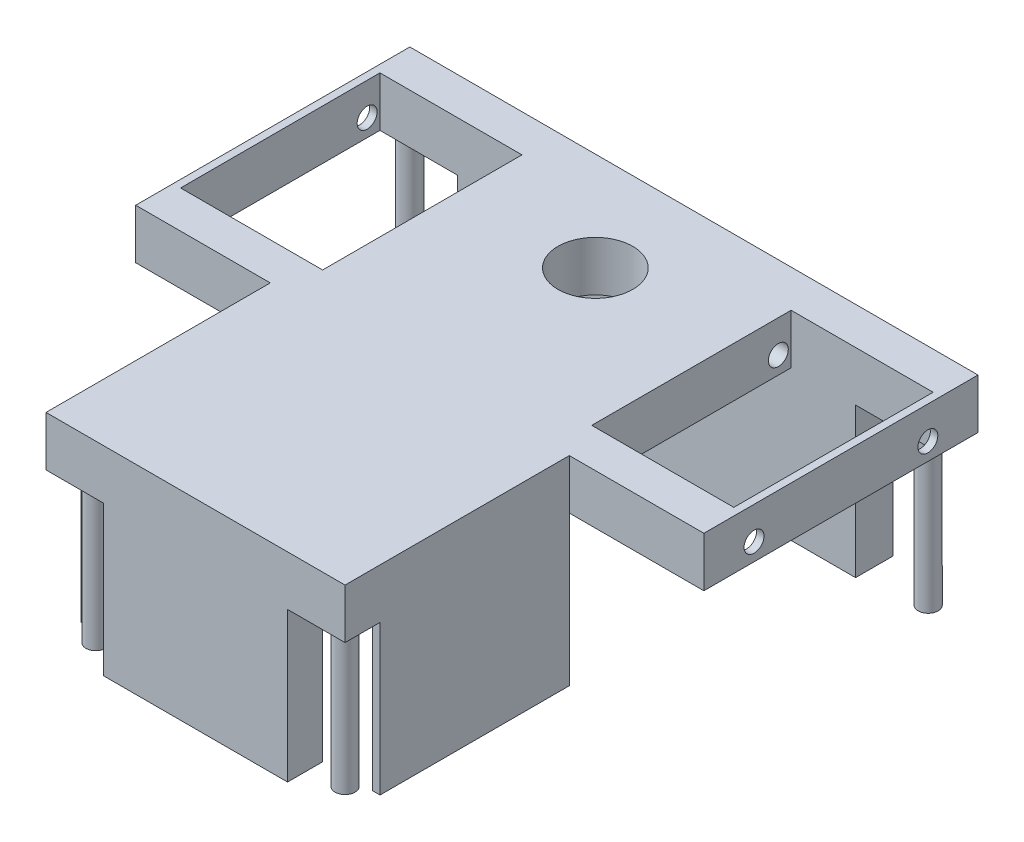
from build123d import *

# Parameters (mm, degrees)
BOSS_EXTRUDE1_DEPTH     = 10
CUT_EXTRUDE1_DEPTH      = 116.537872579
CUT_EXTRUDE1_DEPTH_BACK = 116.537872579
SKETCH2_R               = 2
SKETCH2_W               = 28.5
SKETCH2_H               = 40
SKETCH5_R               = 2
CUT_EXTRUDE2_DEPTH      = 152.973681932
SKETCH6_R               = 2
BOSS_EXTRUDE2_DEPTH     = 40
SKETCH7_W               = 79.874147132
SKETCH7_H               = 7.5
SKETCH7_W_2             = 36.93403835
SKETCH7_H_2             = 7.021862101
SKETCH7_W_3             = 1.5
SKETCH7_H_3             = 37.978137899
BOSS_EXTRUDE3_DEPTH     = 30
CUT_EXTRUDE3_DEPTH      = 122.856472951
CUT_EXTRUDE3_DEPTH_BACK = 122.856472951
SKETCH8_R               = 7.5


with BuildPart() as part:
    # Sketch1 → Boss-Extrude1 (new body)
    with BuildSketch(Plane(origin=(0, 0, 0), x_dir=(1, 0, 0), z_dir=(0, 1, 0))):
        Polygon((30, 0), (-30, 0), (-30, 45), (-57, 45), (-57, 100), (57, 100), (57, 45), (30, 45), align=None)
    extrude(amount=BOSS_EXTRUDE1_DEPTH)

    # Sketch2 → Cut-Extrude1 (cut, two sides: drawn at the far end of the back side and taken through both)
    with BuildSketch(Plane(origin=(0, 10, 0), x_dir=(1, 0, 0), z_dir=(0, 1, 0)).offset(-CUT_EXTRUDE1_DEPTH_BACK)):
        with Locations(Location((-52, 95, 0), (0, 0, 270))):
            Circle(SKETCH2_R)
        with Locations(Location((52, 95, 0), (0, 0, 270))):
            Circle(SKETCH2_R)
        with Locations(Location((-25, 5, 0), (0, 0, 270))):
            Circle(SKETCH2_R)
        with Locations(Location((25, 5, 0), (0, 0, 270))):
            Circle(SKETCH2_R)
        with Locations((-41.25, 72.5)):
            Rectangle(SKETCH2_W, SKETCH2_H)
        with Locations((41.25, 72.5)):
            Rectangle(SKETCH2_W, SKETCH2_H)
    extrude(amount=CUT_EXTRUDE1_DEPTH + CUT_EXTRUDE1_DEPTH_BACK, mode=Mode.SUBTRACT)

    # Sketch5 → Cut-Extrude2 (cut, through all)
    with BuildSketch(Plane(origin=(57, 0, 0), x_dir=(0, 0, -1), z_dir=(1, 0, 0))):
        with Locations(Location((55.064404226, 3.5, 0), (0, 0, 180))):
            Circle(SKETCH5_R)
        with Locations(Location((89.935595774, 3.5, 0), (0, 0, 180))):
            Circle(SKETCH5_R)
    extrude(amount=-CUT_EXTRUDE2_DEPTH, mode=Mode.SUBTRACT)

    # Sketch6 → Boss-Extrude2 (add)
    with BuildSketch(Plane(origin=(0, 10, 0), x_dir=(1, 0, 0), z_dir=(0, 1, 0))):
        with Locations(Location((-25, 5, 0), (0, 0, 270))):
            Circle(SKETCH6_R)
        with Locations(Location((25, 5, 0), (0, 0, 270))):
            Circle(SKETCH6_R)
        with Locations(Location((52, 95, 0), (0, 0, 270))):
            Circle(SKETCH6_R)
        with Locations(Location((-52, 95, 0), (0, 0, 270))):
            Circle(SKETCH6_R)
    extrude(amount=-BOSS_EXTRUDE2_DEPTH)

    # Sketch7 → Boss-Extrude3 (add)
    with BuildSketch(Plane.XZ):
        with Locations((0, -96.25)):
            Rectangle(SKETCH7_W, SKETCH7_H)
        with Locations((0, -3.510931051)):
            Rectangle(SKETCH7_W_2, SKETCH7_H_2)
        with Locations((-29.25, -26.010931051)):
            Rectangle(SKETCH7_W_3, SKETCH7_H_3)
        with Locations((29.25, -26.010931051)):
            Rectangle(SKETCH7_W_3, SKETCH7_H_3)
    extrude(amount=BOSS_EXTRUDE3_DEPTH)

    # Sketch8 → Cut-Extrude3 (cut, two sides: drawn at the far end of the back side and taken through both)
    with BuildSketch(Plane(origin=(0, 10, 0), x_dir=(1, 0, 0), z_dir=(0, 1, 0)).offset(-CUT_EXTRUDE3_DEPTH_BACK)):
        with Locations(Location((0, 80.227050859, 0), (0, 0, 270))):
            Circle(SKETCH8_R)
    extrude(amount=CUT_EXTRUDE3_DEPTH + CUT_EXTRUDE3_DEPTH_BACK, mode=Mode.SUBTRACT)


solid = part.part
